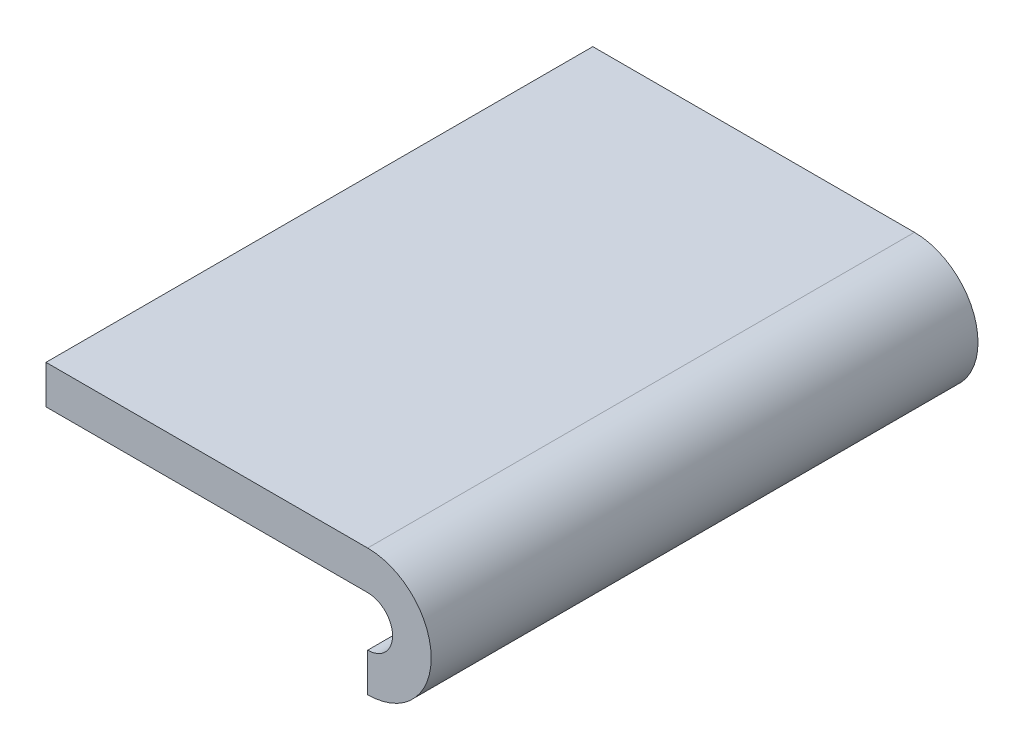
from build123d import *

# Parameters (mm, degrees)
EXTRUDE_THIN1_DEPTH = 170


with BuildPart() as part:
    # Sketch1 → Extrude-Thin1 (new body)
    with BuildSketch(Plane.XY):
        with BuildLine():
            Line((-100, 7.75), (0, 7.75))
            ThreePointArc((0, 7.75), (7.75, 0), (0, -7.75))
            Line((0, -7.75), (0, -19.75))
            ThreePointArc((0, -19.75), (19.75, 0), (0, 19.75))
            Line((0, 19.75), (-100, 19.75))
            Line((-100, 19.75), (-100, 7.75))
        make_face()
    extrude(amount=EXTRUDE_THIN1_DEPTH)


solid = part.part
